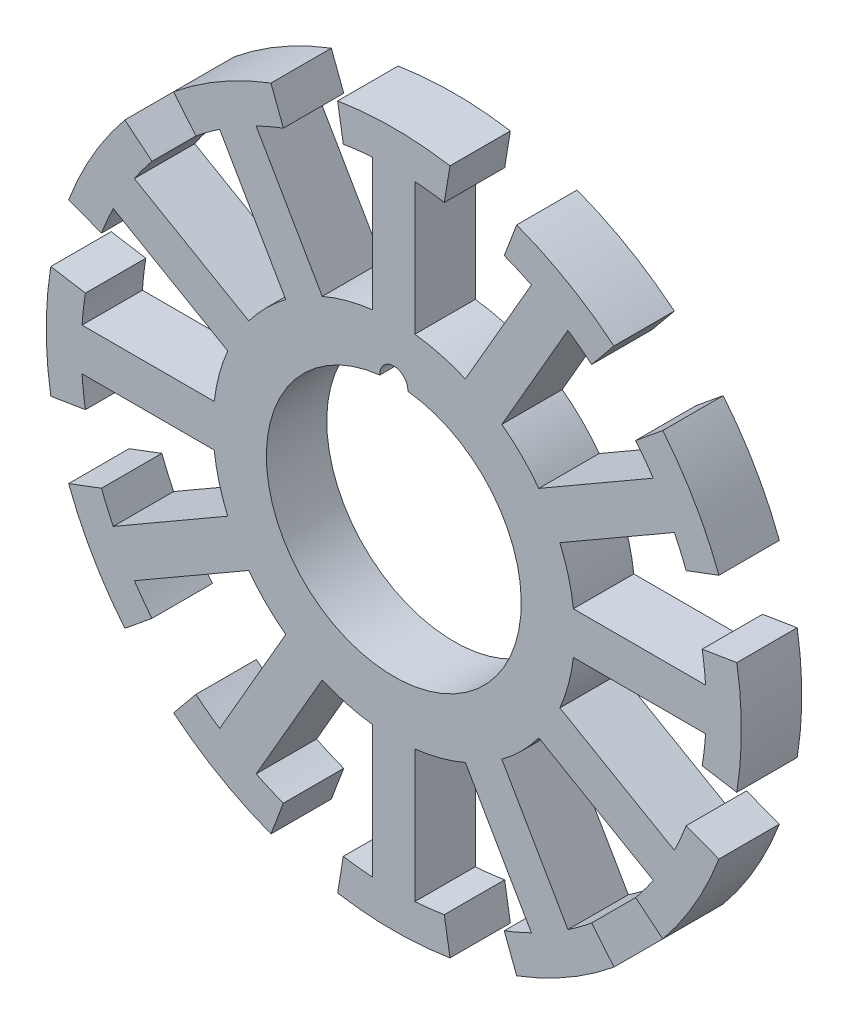
from build123d import *

# Parameters (mm, degrees)
SKETCH1_R          = 12.573
EXTRUDE1_DEPTH     = 2.1844
CUT_EXTRUDE1_DEPTH = 18.914582366
SKETCH4_R          = 4.6101
CUT_EXTRUDE2_DEPTH = 18.914582366
SKETCH5_R          = 0.508
CUT_EXTRUDE3_DEPTH = 18.914582366


with BuildPart() as part:
    # Sketch1 → Extrude1 (new body)
    with BuildSketch(Plane.XY):
        Circle(SKETCH1_R)
    extrude(amount=EXTRUDE1_DEPTH)

    # Sketch2 → Cut-Extrude1 (cut, through all)
    with BuildSketch(Plane.XY.offset(2.1844)):
        with BuildLine():
            Line((-7.159213379, 8.746626366), (-7.963619377, 9.729393373))
            ThreePointArc((-7.963619377, 9.729393373), (-8.89045356, 8.89045356), (-9.729393373, 7.963619377))
            Line((-9.729393373, 7.963619377), (-8.746626366, 7.159213379))
            ThreePointArc((-8.746626366, 7.159213379), (-9.076228299, 6.736459669), (-9.385415604, 6.298554036))
            Line((-9.385415604, 6.298554036), (-5.244666377, 3.907891355))
            ThreePointArc((-5.244666377, 3.907891355), (-4.624831902, 4.624831902), (-3.907891355, 5.244666377))
            Line((-3.907891355, 5.244666377), (-6.298554036, 9.385415604))
            ThreePointArc((-6.298554036, 9.385415604), (-6.736459669, 9.076228299), (-7.159213379, 8.746626366))
        make_face()
        with BuildLine():
            Line((-10.573373841, 3.995193941), (-11.761393373, 4.444092136))
            ThreePointArc((-11.761393373, 4.444092136), (-12.144585414, 3.254131854), (-12.407711513, 2.032))
            Line((-12.407711513, 2.032), (-11.15440732, 1.826747475))
            ThreePointArc((-11.15440732, 1.826747475), (-11.228474112, 1.295831056), (-11.277285356, 0.762))
            Line((-11.277285356, 0.762), (-6.495959994, 0.762))
            ThreePointArc((-6.495959994, 0.762), (-6.317637867, 1.692805964), (-6.006666377, 2.58806864))
            Line((-6.006666377, 2.58806864), (-10.147415604, 4.97873132))
            ThreePointArc((-10.147415604, 4.97873132), (-10.372059354, 4.492014443), (-10.573373841, 3.995193941))
        make_face()
        with BuildLine():
            Line((-11.15440732, -1.826747475), (-12.407711513, -2.032))
            ThreePointArc((-12.407711513, -2.032), (-12.144585414, -3.254131854), (-11.761393373, -4.444092136))
            Line((-11.761393373, -4.444092136), (-10.573373841, -3.995193941))
            ThreePointArc((-10.573373841, -3.995193941), (-10.372059354, -4.492014443), (-10.147415604, -4.97873132))
            Line((-10.147415604, -4.97873132), (-6.006666377, -2.58806864))
            ThreePointArc((-6.006666377, -2.58806864), (-6.317637867, -1.692805964), (-6.495959994, -0.762))
            Line((-6.495959994, -0.762), (-11.277285356, -0.762))
            ThreePointArc((-11.277285356, -0.762), (-11.228474112, -1.295831056), (-11.15440732, -1.826747475))
        make_face()
        with BuildLine():
            Line((-8.746626366, -7.159213379), (-9.729393373, -7.963619377))
            ThreePointArc((-9.729393373, -7.963619377), (-8.89045356, -8.89045356), (-7.963619377, -9.729393373))
            Line((-7.963619377, -9.729393373), (-7.159213379, -8.746626366))
            ThreePointArc((-7.159213379, -8.746626366), (-6.736459669, -9.076228299), (-6.298554036, -9.385415604))
            Line((-6.298554036, -9.385415604), (-3.907891355, -5.244666377))
            ThreePointArc((-3.907891355, -5.244666377), (-4.624831902, -4.624831902), (-5.244666377, -3.907891355))
            Line((-5.244666377, -3.907891355), (-9.385415604, -6.298554036))
            ThreePointArc((-9.385415604, -6.298554036), (-9.076228299, -6.736459669), (-8.746626366, -7.159213379))
        make_face()
        with BuildLine():
            ThreePointArc((-4.444092136, -11.761393373), (-3.254131854, -12.144585414), (-2.032, -12.407711513))
            Line((-2.032, -12.407711513), (-1.826747475, -11.15440732))
            ThreePointArc((-1.826747475, -11.15440732), (-1.295831056, -11.228474112), (-0.762, -11.277285356))
            Line((-0.762, -11.277285356), (-0.762, -6.495959994))
            ThreePointArc((-0.762, -6.495959994), (-1.692805964, -6.317637867), (-2.58806864, -6.006666377))
            Line((-2.58806864, -6.006666377), (-4.97873132, -10.147415604))
            ThreePointArc((-4.97873132, -10.147415604), (-4.492014443, -10.372059354), (-3.995193941, -10.573373841))
            Line((-3.995193941, -10.573373841), (-4.444092136, -11.761393373))
        make_face()
        with BuildLine():
            ThreePointArc((2.032, -12.407711513), (3.254131854, -12.144585414), (4.444092136, -11.761393373))
            Line((4.444092136, -11.761393373), (3.995193941, -10.573373841))
            ThreePointArc((3.995193941, -10.573373841), (4.492014443, -10.372059354), (4.97873132, -10.147415604))
            Line((4.97873132, -10.147415604), (2.58806864, -6.006666377))
            ThreePointArc((2.58806864, -6.006666377), (1.692805964, -6.317637867), (0.762, -6.495959994))
            Line((0.762, -6.495959994), (0.762, -11.277285356))
            ThreePointArc((0.762, -11.277285356), (1.295831056, -11.228474112), (1.826747475, -11.15440732))
            Line((1.826747475, -11.15440732), (2.032, -12.407711513))
        make_face()
        with BuildLine():
            ThreePointArc((7.963619377, -9.729393373), (8.89045356, -8.89045356), (9.729393373, -7.963619377))
            Line((9.729393373, -7.963619377), (8.746626366, -7.159213379))
            ThreePointArc((8.746626366, -7.159213379), (9.076228299, -6.736459669), (9.385415604, -6.298554036))
            Line((9.385415604, -6.298554036), (5.244666377, -3.907891355))
            ThreePointArc((5.244666377, -3.907891355), (4.624831902, -4.624831902), (3.907891355, -5.244666377))
            Line((3.907891355, -5.244666377), (6.298554036, -9.385415604))
            ThreePointArc((6.298554036, -9.385415604), (6.736459669, -9.076228299), (7.159213379, -8.746626366))
            Line((7.159213379, -8.746626366), (7.963619377, -9.729393373))
        make_face()
        with BuildLine():
            ThreePointArc((11.761393373, -4.444092136), (12.144585414, -3.254131854), (12.407711513, -2.032))
            Line((12.407711513, -2.032), (11.15440732, -1.826747475))
            ThreePointArc((11.15440732, -1.826747475), (11.228474112, -1.295831056), (11.277285356, -0.762))
            Line((11.277285356, -0.762), (6.495959994, -0.762))
            ThreePointArc((6.495959994, -0.762), (6.317637867, -1.692805964), (6.006666377, -2.58806864))
            Line((6.006666377, -2.58806864), (10.147415604, -4.97873132))
            ThreePointArc((10.147415604, -4.97873132), (10.372059354, -4.492014443), (10.573373841, -3.995193941))
            Line((10.573373841, -3.995193941), (11.761393373, -4.444092136))
        make_face()
        with BuildLine():
            ThreePointArc((12.407711513, 2.032), (12.144585414, 3.254131854), (11.761393373, 4.444092136))
            Line((11.761393373, 4.444092136), (10.573373841, 3.995193941))
            ThreePointArc((10.573373841, 3.995193941), (10.372059354, 4.492014443), (10.147415604, 4.97873132))
            Line((10.147415604, 4.97873132), (6.006666377, 2.58806864))
            ThreePointArc((6.006666377, 2.58806864), (6.317637867, 1.692805964), (6.495959994, 0.762))
            Line((6.495959994, 0.762), (11.277285356, 0.762))
            ThreePointArc((11.277285356, 0.762), (11.228474112, 1.295831056), (11.15440732, 1.826747475))
            Line((11.15440732, 1.826747475), (12.407711513, 2.032))
        make_face()
        with BuildLine():
            ThreePointArc((9.729393373, 7.963619377), (8.89045356, 8.89045356), (7.963619377, 9.729393373))
            Line((7.963619377, 9.729393373), (7.159213379, 8.746626366))
            ThreePointArc((7.159213379, 8.746626366), (6.736459669, 9.076228299), (6.298554036, 9.385415604))
            Line((6.298554036, 9.385415604), (3.907891355, 5.244666377))
            ThreePointArc((3.907891355, 5.244666377), (4.624831902, 4.624831902), (5.244666377, 3.907891355))
            Line((5.244666377, 3.907891355), (9.385415604, 6.298554036))
            ThreePointArc((9.385415604, 6.298554036), (9.076228299, 6.736459669), (8.746626366, 7.159213379))
            Line((8.746626366, 7.159213379), (9.729393373, 7.963619377))
        make_face()
        with BuildLine():
            ThreePointArc((4.97873132, 10.147415604), (4.492014443, 10.372059354), (3.995193941, 10.573373841))
            Line((3.995193941, 10.573373841), (4.444092136, 11.761393373))
            ThreePointArc((4.444092136, 11.761393373), (3.254131854, 12.144585414), (2.032, 12.407711513))
            Line((2.032, 12.407711513), (1.826747475, 11.15440732))
            ThreePointArc((1.826747475, 11.15440732), (1.295831056, 11.228474112), (0.762, 11.277285356))
            Line((0.762, 11.277285356), (0.762, 6.495959994))
            ThreePointArc((0.762, 6.495959994), (1.692805964, 6.317637867), (2.58806864, 6.006666377))
            Line((2.58806864, 6.006666377), (4.97873132, 10.147415604))
        make_face()
        with BuildLine():
            Line((-1.826747475, 11.15440732), (-2.032, 12.407711513))
            ThreePointArc((-2.032, 12.407711513), (-3.254131854, 12.144585414), (-4.444092136, 11.761393373))
            Line((-4.444092136, 11.761393373), (-3.995193941, 10.573373841))
            ThreePointArc((-3.995193941, 10.573373841), (-4.492014443, 10.372059354), (-4.97873132, 10.147415604))
            Line((-4.97873132, 10.147415604), (-2.58806864, 6.006666377))
            ThreePointArc((-2.58806864, 6.006666377), (-1.692805964, 6.317637867), (-0.762, 6.495959994))
            Line((-0.762, 6.495959994), (-0.762, 11.277285356))
            ThreePointArc((-0.762, 11.277285356), (-1.295831056, 11.228474112), (-1.826747475, 11.15440732))
        make_face()
    extrude(amount=-CUT_EXTRUDE1_DEPTH, mode=Mode.SUBTRACT)

    # Sketch4 → Cut-Extrude2 (cut, through all)
    with BuildSketch(Plane.XY.offset(2.1844)):
        Circle(SKETCH4_R)
    extrude(amount=-CUT_EXTRUDE2_DEPTH, mode=Mode.SUBTRACT)

    # Sketch5 → Cut-Extrude3 (cut, through all)
    with BuildSketch(Plane.XY.offset(2.1844)):
        with Locations((0, 4.6101)):
            Circle(SKETCH5_R)
    extrude(amount=-CUT_EXTRUDE3_DEPTH, mode=Mode.SUBTRACT)


solid = part.part
